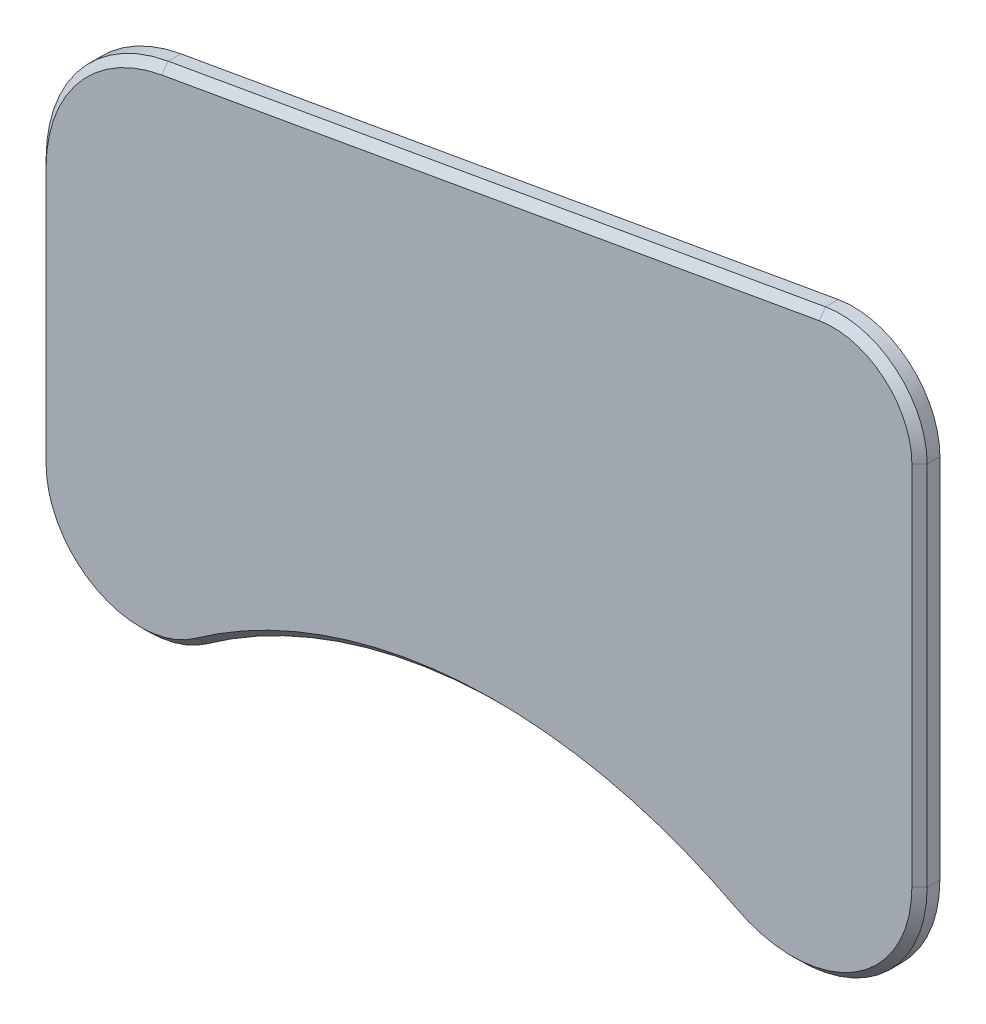
from build123d import *

# Parameters (mm, degrees)
BOSS_EXTRUDE1_DEPTH = 4
CHAMFER1_SIZE       = 1.5


with BuildPart() as part:
    # Sketch1 → Boss-Extrude1 (new body)
    with BuildSketch(Plane.XY):
        with BuildLine():
            Line((70.04798098, 42.798720736), (-59.035797152, 20.037767879))
            ThreePointArc((-59.035797152, 20.037767879), (-76.21528885, 10.119183723), (-83, -8.521656958))
            Line((-83, -8.521656958), (-83, -58.921656958))
            ThreePointArc((-83, -58.921656958), (-72.147912935, -76.706923022), (-51.368431106, -75.191463505))
            ThreePointArc((-51.368431106, -75.191463505), (-0.018293401, -56.7724897), (53.357882673, -68.045424814))
            ThreePointArc((53.357882673, -68.045424814), (77.92182392, -67.32320986), (90, -45.921656958))
            Line((90, -45.921656958), (90, 26.056988934))
            ThreePointArc((90, 26.056988934), (83.927389365, 39.079744467), (70.04798098, 42.798720736))
        make_face()
    extrude(amount=BOSS_EXTRUDE1_DEPTH)

    # Chamfer1
    chamfer1_edges = [part.edges().sort_by_distance(p)[0] for p in [
        (-76.21528885, 10.119183723, 4),
        (-83, -33.721656958, 4),
        (-72.147912935, -76.706923022, 4),
        (-0.018293401, -56.7724897, 4),
        (77.92182392, -67.32320986, 4),
        (90, -9.932334012, 4),
        (83.927389365, 39.079744467, 4),
        (5.506091914, 31.418244307, 4),
    ]]
    chamfer(chamfer1_edges, length=CHAMFER1_SIZE)


solid = part.part
